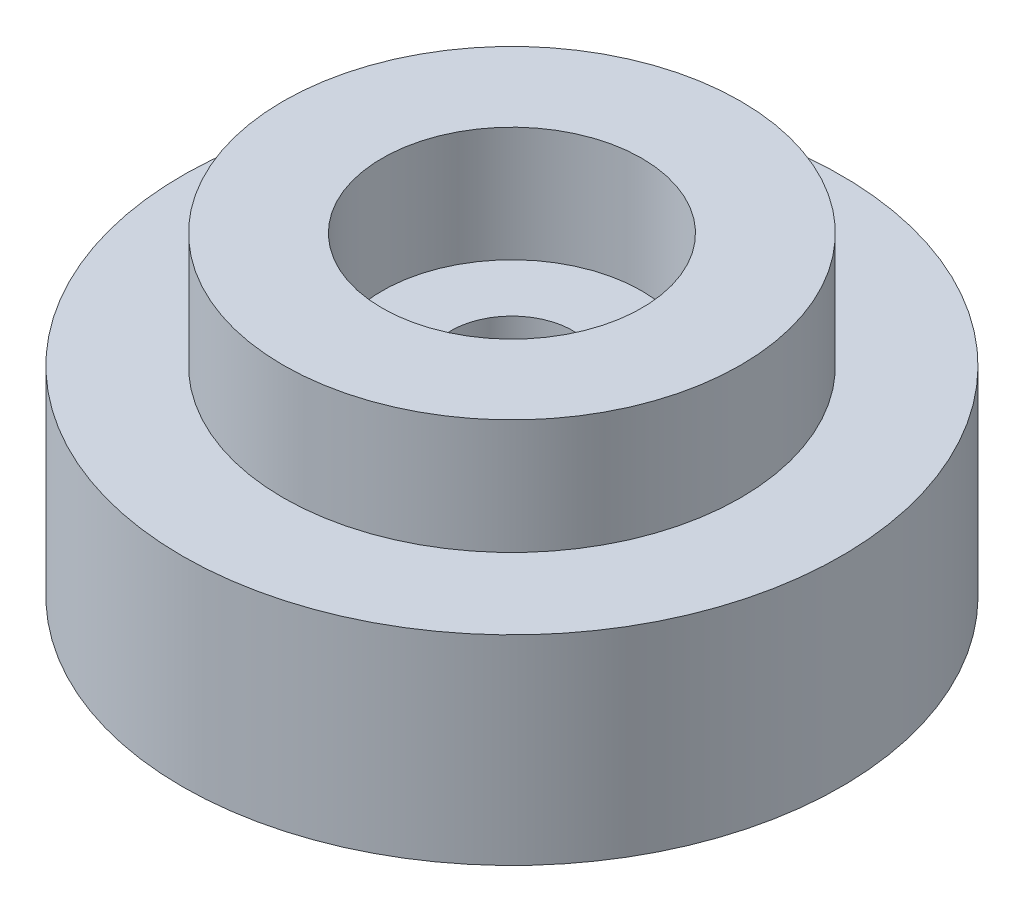
from build123d import *

# Parameters (mm, degrees)
SKETCH1_R               = 16.5
BOSS_EXTRUDE1_DEPTH     = 10
SKETCH2_R               = 3.05
CUT_EXTRUDE1_DEPTH      = 1.25
SKETCH4_W               = 4.95
SKETCH4_H               = 5.75
CUT_EXTRUDE2_DEPTH      = 25.921125577
CUT_EXTRUDE2_DEPTH_BACK = 25.921125577
SKETCH5_R               = 2


with BuildPart() as part:
    # Sketch1 → Boss-Extrude1 (new body)
    with BuildSketch(Plane(origin=(0, 0, 0), x_dir=(1, 0, 0), z_dir=(0, 1, 0))):
        with Locations(Location((0, 0, 0), (0, 0, 270))):
            Circle(SKETCH1_R)
    extrude(amount=BOSS_EXTRUDE1_DEPTH)

    # Sketch2 → Cut-Extrude1 (cut)
    with BuildSketch(Plane(origin=(0, 10, 0), x_dir=(1, 0, 0), z_dir=(0, 1, 0))):
        with Locations(Location((0, 0, 0), (0, 0, 270))):
            Circle(SKETCH2_R)
    extrude(amount=-CUT_EXTRUDE1_DEPTH, mode=Mode.SUBTRACT)

    # Sketch4 → Revolve1 (revolve)
    with BuildSketch(Plane.XY, mode=Mode.PRIVATE) as revolve1_sk:
        with Locations((8.975, 12.875)):
            Rectangle(SKETCH4_W, SKETCH4_H)
    revolve(revolve1_sk.sketch.rotate(Axis((0, -0.517946451, 0), (0, 1, 0)), 90), axis=Axis((0, -0.517946451, 0), (0, 1, 0)))

    # Sketch5 → Cut-Extrude2 (cut, two sides: drawn at the far end of the back side and taken through both)
    with BuildSketch(Plane(origin=(0, 8.75, 0), x_dir=(1, 0, 0), z_dir=(0, 1, 0)).offset(-CUT_EXTRUDE2_DEPTH_BACK)):
        with Locations(Location((0, 0, 0), (0, 0, 270))):
            Circle(SKETCH5_R)
    extrude(amount=CUT_EXTRUDE2_DEPTH + CUT_EXTRUDE2_DEPTH_BACK, mode=Mode.SUBTRACT)


solid = part.part
